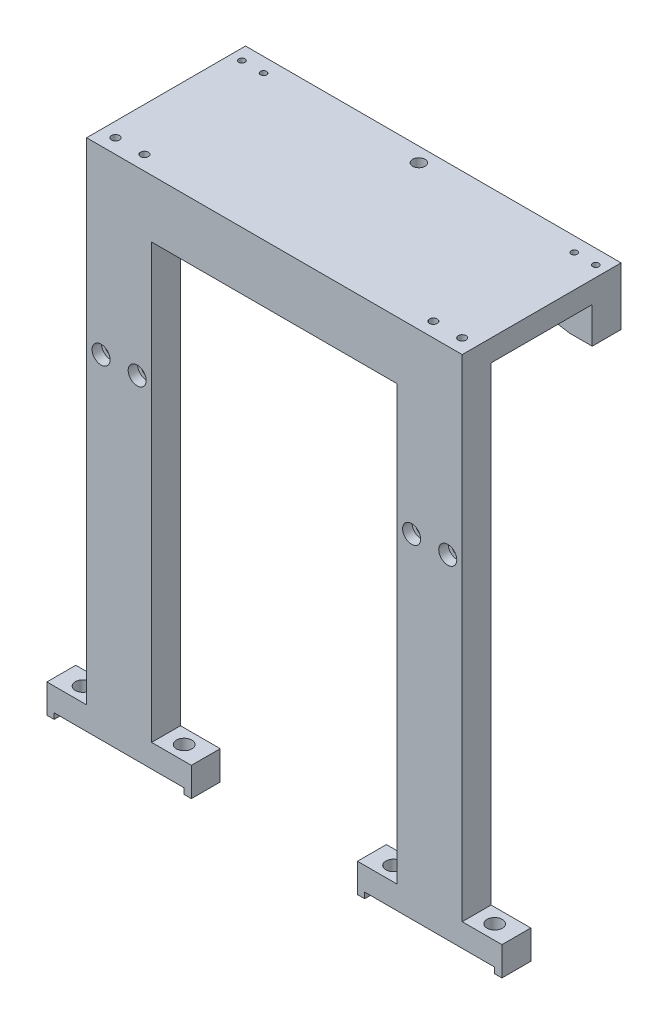
from build123d import *

# Parameters (mm, degrees)
SKETCH1_W                                      = 165.1
SKETCH1_H                                      = 228.6
BOSS_EXTRUDE1_DEPTH                            = 12.7
SKETCH2_W                                      = 107.95
SKETCH2_H                                      = 203.2
CUT_EXTRUDE1_DEPTH                             = 142.563704741
SKETCH3_W                                      = 165.1
SKETCH3_H                                      = 9.525
BOSS_EXTRUDE2_DEPTH                            = 57.15
SKETCH4_W                                      = 19.05
SKETCH4_H                                      = 15.875
BOSS_EXTRUDE3_DEPTH                            = 12.7
CUT_EXTRUDE2_REACH                             = 159.347
SKETCH7_W                                      = 63.5
SKETCH7_H                                      = 12.7
BOSS_EXTRUDE4_DEPTH                            = 12.7
SKETCH8_W                                      = 57.15
SKETCH8_H                                      = 12.7
CUT_EXTRUDE4_DEPTH                             = 2.54
F_8_32_TAPPED_HOLE1_D                          = 3.4544
F_8_32_TAPPED_HOLE1_DEPTH                      = 12.7
F_8_32_TAPPED_HOLE1_TIP                        = 1.037806461
F_1_4_CLEARANCE_HOLE1_D                        = 6.7564
F_1_4_CLEARANCE_HOLE1_DEPTH                    = 10.16
F_6_32_TAPPED_HOLE2_D                          = 2.7051
F_1_4_28_TAPPED_HOLE1_D                        = 5.4102
CBORE_FOR_8_SOCKET_HEAD_CAP_SCREW1_D           = 4.4958
CBORE_FOR_8_SOCKET_HEAD_CAP_SCREW1_CBORE_D     = 7.9375
CBORE_FOR_8_SOCKET_HEAD_CAP_SCREW1_CBORE_DEPTH = 4.1656


with BuildPart() as part:
    # Sketch1 → Boss-Extrude1 (new body)
    with BuildSketch(Plane.XY):
        Rectangle(SKETCH1_W, SKETCH1_H)
    extrude(amount=BOSS_EXTRUDE1_DEPTH)

    # Sketch2 → Cut-Extrude1 (cut, through all)
    with BuildSketch(Plane.XY.offset(12.7)):
        with Locations((0, -12.7)):
            Rectangle(SKETCH2_W, SKETCH2_H)
    extrude(amount=-CUT_EXTRUDE1_DEPTH, mode=Mode.SUBTRACT)

    # Sketch3 → Boss-Extrude2 (add)
    with BuildSketch(Plane(origin=(0, 0, 0), x_dir=(-1, 0, 0), z_dir=(0, 0, -1))):
        with Locations((0, 109.5375)):
            Rectangle(SKETCH3_W, SKETCH3_H)
    extrude(amount=BOSS_EXTRUDE2_DEPTH)

    # Sketch4 → Boss-Extrude3 (add)
    with BuildSketch(Plane(origin=(0, 0, -57.15), x_dir=(-1, 0, 0), z_dir=(0, 0, -1))):
        with Locations((-73.025, 96.8375)):
            Rectangle(SKETCH4_W, SKETCH4_H)
    boss_extrude3 = extrude(amount=-BOSS_EXTRUDE3_DEPTH)

    # Mirror1: Boss-Extrude3 across plane
    add(boss_extrude3.mirror(Plane(origin=(0, 0, 0), x_dir=(0, 0, 1), z_dir=(1, 0, 0))))

    # Sketch5 → Cut-Extrude2 (cut, up to next)
    with BuildSketch(Plane(origin=(0, 0, -57.15), x_dir=(-1, 0, 0), z_dir=(0, 0, -1)), mode=Mode.PRIVATE) as cut_extrude2_sk1:
        Polygon((-72.503159889, 88.9), (-63.5, 90.4875), (-63.5, 88.9), align=None)
    cut_extrude2_tool1 = extrude(cut_extrude2_sk1.sketch, amount=-CUT_EXTRUDE2_REACH, mode=Mode.PRIVATE) & part.part
    cut_extrude2 = cut_extrude2_tool1.solids().sort_by_distance((66.501053, 89.429167, -57.15))[0]
    add(cut_extrude2, mode=Mode.SUBTRACT)

    # Mirror2: Cut-Extrude2 across plane
    add(cut_extrude2.mirror(Plane(origin=(0, 0, 0), x_dir=(0, 0, 1), z_dir=(1, 0, 0))), mode=Mode.SUBTRACT)

    # Sketch7 → Boss-Extrude4 (add)
    with BuildSketch(Plane.XY.offset(12.7)):
        with Locations((-68.2625, -107.95)):
            Rectangle(SKETCH7_W, SKETCH7_H)
    boss_extrude4 = extrude(amount=-BOSS_EXTRUDE4_DEPTH)

    # Sketch8 → Cut-Extrude4 (cut)
    with BuildSketch(Plane(origin=(0, -114.3, 0), x_dir=(-1, 0, 0), z_dir=(0, -1, 0))):
        with Locations((68.2625, -6.35)):
            Rectangle(SKETCH8_W, SKETCH8_H)
    cut_extrude4 = extrude(amount=-CUT_EXTRUDE4_DEPTH, mode=Mode.SUBTRACT)

    # Mirror3: Boss-Extrude4, Cut-Extrude4 across plane
    add(boss_extrude4.mirror(Plane(origin=(0, 0, 0), x_dir=(0, 0, 1), z_dir=(1, 0, 0))))
    add(cut_extrude4.mirror(Plane(origin=(0, 0, 0), x_dir=(0, 0, 1), z_dir=(1, 0, 0))), mode=Mode.SUBTRACT)

    # #8-32 Tapped Hole1
    with Locations(Plane(origin=(0, 114.3, 0), x_dir=(1, 0, 0), z_dir=(0, 1, 0))):
        with Locations((-76.2, -6.35), (-63.5, -6.35), (63.5, -6.35), (76.2, -6.35)):
            Hole(F_8_32_TAPPED_HOLE1_D / 2, depth=F_8_32_TAPPED_HOLE1_DEPTH)
            with Locations((0, 0, -(F_8_32_TAPPED_HOLE1_DEPTH + F_8_32_TAPPED_HOLE1_TIP / 2))):  # 118° drill point
                Cone(0, F_8_32_TAPPED_HOLE1_D / 2, F_8_32_TAPPED_HOLE1_TIP, mode=Mode.SUBTRACT)

    # 1/4 Clearance Hole1
    with Locations(Plane(origin=(0, -101.6, 0), x_dir=(1, 0, 0), z_dir=(0, 1, 0))):
        with Locations((-90.4875, -6.35), (-46.0375, -6.35), (46.0375, -6.35), (90.4875, -6.35)):
            Hole(F_1_4_CLEARANCE_HOLE1_D / 2, depth=F_1_4_CLEARANCE_HOLE1_DEPTH)

    # #6-32 Tapped Hole2 (through all)
    with Locations(Plane(origin=(0, 88.9, 0), x_dir=(-1, 0, 0), z_dir=(0, -1, 0))):
        with Locations((77.7875, 50.8), (68.2625, 50.8), (-77.7875, 50.8), (-68.2625, 50.8)):
            Hole(F_6_32_TAPPED_HOLE2_D / 2)

    # 1/4-28 Tapped Hole1 (through all)
    with Locations(Plane(origin=(0, 114.3, 0), x_dir=(1, 0, 0), z_dir=(0, 1, 0))):
        with Locations((0, 50.8)):
            Hole(F_1_4_28_TAPPED_HOLE1_D / 2)

    # CBORE for #8 Socket Head Cap Screw1 (through all)
    with Locations(Plane.XY.offset(12.7)):
        with Locations((-76.2, 34.925), (-60.325, 34.925), (60.325, 34.925), (76.2, 34.925)):
            CounterBoreHole(CBORE_FOR_8_SOCKET_HEAD_CAP_SCREW1_D / 2, CBORE_FOR_8_SOCKET_HEAD_CAP_SCREW1_CBORE_D / 2, CBORE_FOR_8_SOCKET_HEAD_CAP_SCREW1_CBORE_DEPTH)


solid = part.part
